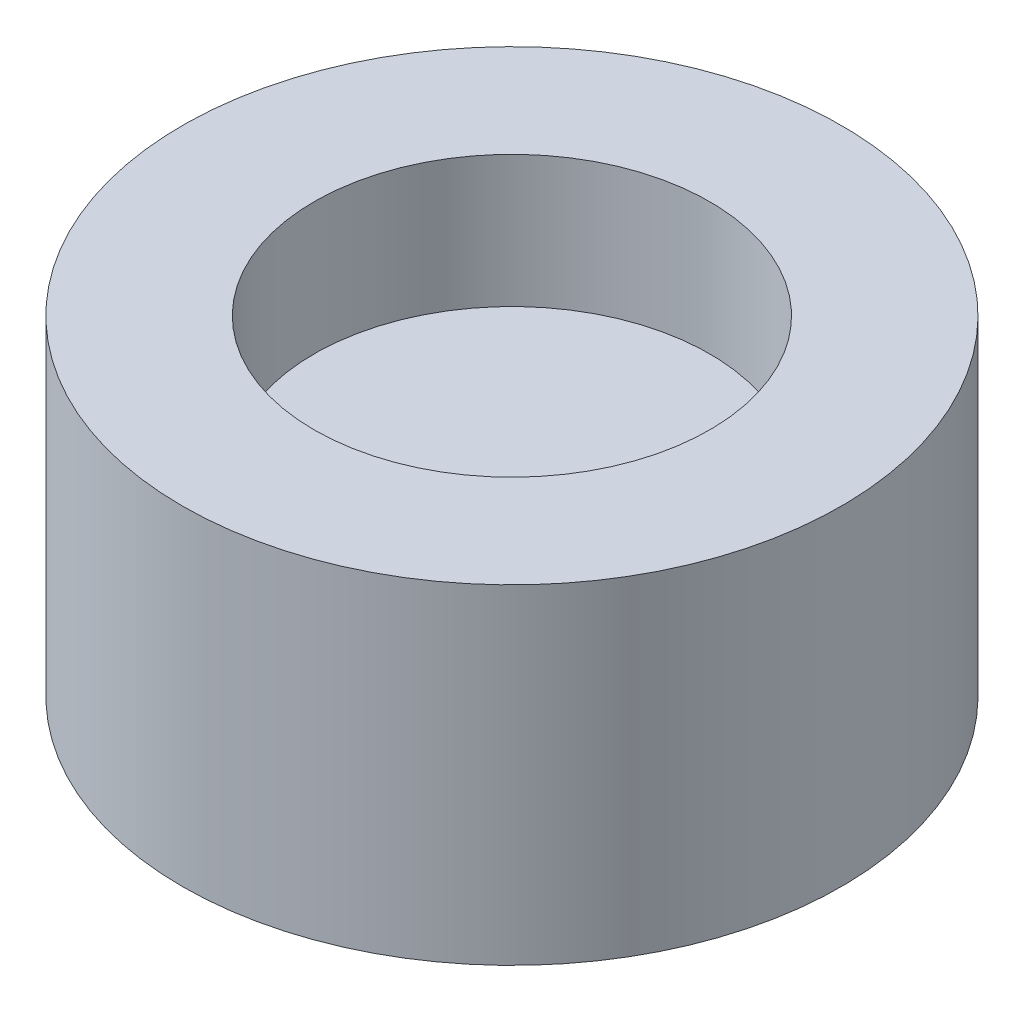
from build123d import *

# Parameters (mm, degrees)
SKETCH2_R           = 2.5
BOSS_EXTRUDE1_DEPTH = 2.5
SKETCH3_R           = 1.5
CUT_EXTRUDE1_DEPTH  = 1


with BuildPart() as part:
    # Sketch2 → Boss-Extrude1 (new body)
    with BuildSketch(Plane(origin=(0, 0, 0), x_dir=(1, 0, 0), z_dir=(0, 1, 0))):
        with Locations(Location((0, 0, 0), (0, 0, 270))):
            Circle(SKETCH2_R)
    extrude(amount=BOSS_EXTRUDE1_DEPTH)

    # Sketch3 → Cut-Extrude1 (cut)
    with BuildSketch(Plane(origin=(0, 2.5, 0), x_dir=(1, 0, 0), z_dir=(0, 1, 0))):
        with Locations(Location((0, 0, 0), (0, 0, 270))):
            Circle(SKETCH3_R)
    extrude(amount=-CUT_EXTRUDE1_DEPTH, mode=Mode.SUBTRACT)


solid = part.part
